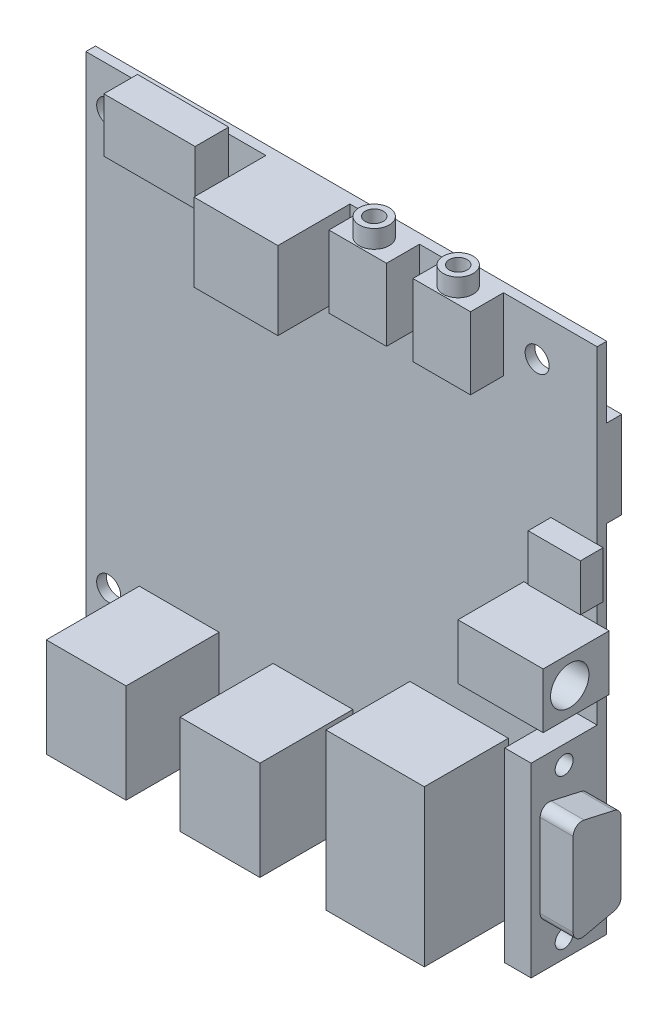
from build123d import *

# Parameters (mm, degrees)
SCHIZZO1_W                    = 85.2
SCHIZZO1_H                    = 85.6
SCHIZZO1_R                    = 2
ESTRUSIONE_ESTRUSIONE1_DEPTH  = 1.6
SCHIZZO3_W                    = 15.2
SCHIZZO3_H                    = 9
ESTRUSIONE_ESTRUSIONE2_DEPTH  = 5.6
SCHIZZO4_W                    = 14
SCHIZZO4_H                    = 13
ESTRUSIONE_ESTRUSIONE3_DEPTH  = 12
SCHIZZO5_W                    = 9.6
SCHIZZO5_H                    = 12
ESTRUSIONE_ESTRUSIONE4_DEPTH  = 5.5
SCHIZZO6_R                    = 2.5
SCHIZZO6_R_2                  = 1.5
ESTRUSIONE_SOTTILE1_DEPTH     = 3
SCHIZZO7_W                    = 16
SCHIZZO7_H                    = 14.5
ESTRUSIONE_ESTRUSIONE5_DEPTH  = 2.5
SCHIZZO8_W                    = 8.7
SCHIZZO8_H                    = 7.8
ESTRUSIONE_ESTRUSIONE6_DEPTH  = 3.8
SCHIZZO9_W                    = 14.2
SCHIZZO9_H                    = 9.2
ESTRUSIONE_ESTRUSIONE7_DEPTH  = 11
SCHIZZO10_R                   = 3.2
TAGLIO_ESTRUSIONE1_DEPTH      = 10
SCHIZZO11_W                   = 4.4
SCHIZZO11_H                   = 31
ESTRUSIONE_ESTRUSIONE8_DEPTH  = 11
ESTRUSIONE_ESTRUSIONE9_DEPTH  = 5.5
SCHIZZO14_R                   = 1.5
TAGLIO_ESTRUSIONE2_DEPTH      = 5.5
SCHIZZO15_W                   = 16.4
SCHIZZO15_H                   = 26
ESTRUSIONE_ESTRUSIONE10_DEPTH = 14
SCHIZZO16_W                   = 13.3
SCHIZZO16_H                   = 16.5
ESTRUSIONE_ESTRUSIONE11_DEPTH = 15.5
SCHIZZO17_W                   = 7.3
SCHIZZO17_H                   = 13
SCHIZZO17_W_2                 = 5
SCHIZZO17_H_2                 = 35.6
ESTRUSIONE_ESTRUSIONE12_DEPTH = 3.9


with BuildPart() as part:
    # Schizzo1 → Estrusione-Estrusione1 (new body)
    with BuildSketch(Plane.XY):
        Rectangle(SCHIZZO1_W, SCHIZZO1_H)
        with Locations((-38.8, 36)):
            Circle(SCHIZZO1_R, mode=Mode.SUBTRACT)
        with Locations((32.6, 36)):
            Circle(SCHIZZO1_R, mode=Mode.SUBTRACT)
        with Locations((-38.8, -32.8)):
            Circle(SCHIZZO1_R, mode=Mode.SUBTRACT)
        with Locations((32.6, -32.8)):
            Circle(SCHIZZO1_R, mode=Mode.SUBTRACT)
    extrude(amount=ESTRUSIONE_ESTRUSIONE1_DEPTH)

    # Schizzo3 → Estrusione-Estrusione2 (add)
    with BuildSketch(Plane.XY.offset(1.6)):
        with Locations((-26.4, 39.3)):
            Rectangle(SCHIZZO3_W, SCHIZZO3_H)
    extrude(amount=ESTRUSIONE_ESTRUSIONE2_DEPTH)

    # Schizzo4 → Estrusione-Estrusione3 (add)
    with BuildSketch(Plane.XY.offset(1.6)):
        with Locations((-5.6, 36.3)):
            Rectangle(SCHIZZO4_W, SCHIZZO4_H)
    extrude(amount=ESTRUSIONE_ESTRUSIONE3_DEPTH)

    # Schizzo5 → Estrusione-Estrusione4 (add)
    with BuildSketch(Plane.XY.offset(1.6)):
        with Locations((8.2, 36.8)):
            Rectangle(SCHIZZO5_W, SCHIZZO5_H)
        with Locations((22.2, 36.8)):
            Rectangle(SCHIZZO5_W, SCHIZZO5_H)
    extrude(amount=ESTRUSIONE_ESTRUSIONE4_DEPTH)

    # Schizzo6 → Estrusione-Sottile1 (add)
    # profile 1 of 2: a face of its own
    with BuildSketch(Plane(origin=(0, 42.8, 0), x_dir=(1, 0, 0), z_dir=(0, 1, 0))):
        with Locations((8.2, -4.35)):
            Circle(SCHIZZO6_R)
        with Locations((8.2, -4.35)):
            Circle(SCHIZZO6_R_2, mode=Mode.SUBTRACT)
    # profile 2 of 2: a face of its own
    with BuildSketch(Plane(origin=(0, 42.8, 0), x_dir=(1, 0, 0), z_dir=(0, 1, 0))):
        with Locations((22.2, -4.35)):
            Circle(SCHIZZO6_R)
        with Locations((22.2, -4.35)):
            Circle(SCHIZZO6_R_2, mode=Mode.SUBTRACT)
    extrude(amount=ESTRUSIONE_SOTTILE1_DEPTH)

    # Schizzo7 → Estrusione-Estrusione5 (add)
    with BuildSketch(Plane(origin=(0, 0, 0), x_dir=(-1, 0, 0), z_dir=(0, 0, -1))):
        with Locations((-34.6, 23.75)):
            Rectangle(SCHIZZO7_W, SCHIZZO7_H)
    extrude(amount=ESTRUSIONE_ESTRUSIONE5_DEPTH)

    # Schizzo8 → Estrusione-Estrusione6 (add)
    with BuildSketch(Plane.XY.offset(1.6)):
        with Locations((39.25, 10.4)):
            Rectangle(SCHIZZO8_W, SCHIZZO8_H)
    extrude(amount=ESTRUSIONE_ESTRUSIONE6_DEPTH)

    # Schizzo9 → Estrusione-Estrusione7 (add)
    with BuildSketch(Plane.XY.offset(1.6)):
        with Locations((37.5, -1.8)):
            Rectangle(SCHIZZO9_W, SCHIZZO9_H)
    extrude(amount=ESTRUSIONE_ESTRUSIONE7_DEPTH)

    # Schizzo10 → Taglio-Estrusione1 (cut)
    with BuildSketch(Plane(origin=(44.6, 0, 0), x_dir=(0, 0, -1), z_dir=(1, 0, 0))):
        with Locations((-8.163212145, -1.8)):
            Circle(SCHIZZO10_R)
    extrude(amount=-TAGLIO_ESTRUSIONE1_DEPTH, mode=Mode.SUBTRACT)

    # Schizzo11 → Estrusione-Estrusione8 (add)
    with BuildSketch(Plane.XY.offset(1.6)):
        with Locations((40.4, -27.3)):
            Rectangle(SCHIZZO11_W, SCHIZZO11_H)
    extrude(amount=ESTRUSIONE_ESTRUSIONE8_DEPTH)

    # Schizzo12 → Estrusione-Estrusione9 (add)
    with BuildSketch(Plane(origin=(42.6, 0, 0), x_dir=(0, 0, -1), z_dir=(1, 0, 0))):
        with BuildLine():
            Line((-11.1, -34.225), (-11.1, -20.375))
            ThreePointArc((-11.1, -20.375), (-10.537042571, -19.203696786), (-9.270731707, -18.911585366))
            Line((-9.270731707, -18.911585366), (-4.270731707, -20.036585366))
            ThreePointArc((-4.270731707, -20.036585366), (-3.428696786, -20.562957429), (-3.1, -21.5))
            Line((-3.1, -21.5), (-3.1, -33.1))
            ThreePointArc((-3.1, -33.1), (-3.428696786, -34.037042571), (-4.270731707, -34.563414634))
            Line((-4.270731707, -34.563414634), (-9.270731707, -35.688414634))
            ThreePointArc((-9.270731707, -35.688414634), (-10.537042571, -35.396303214), (-11.1, -34.225))
        make_face()
    extrude(amount=ESTRUSIONE_ESTRUSIONE9_DEPTH)

    # Schizzo14 → Taglio-Estrusione2 (cut)
    with BuildSketch(Plane(origin=(42.6, 0, 0), x_dir=(0, 0, -1), z_dir=(1, 0, 0))):
        with Locations((-7.1, -14.8)):
            Circle(SCHIZZO14_R)
        with Locations((-7.1, -39.8)):
            Circle(SCHIZZO14_R)
    extrude(amount=-TAGLIO_ESTRUSIONE2_DEPTH, mode=Mode.SUBTRACT)

    # Schizzo15 → Estrusione-Estrusione10 (add)
    with BuildSketch(Plane.XY.offset(1.6)):
        with Locations((19.6, -34.1)):
            Rectangle(SCHIZZO15_W, SCHIZZO15_H)
    extrude(amount=ESTRUSIONE_ESTRUSIONE10_DEPTH)

    # Schizzo16 → Estrusione-Estrusione11 (add)
    with BuildSketch(Plane.XY.offset(1.6)):
        with Locations((-27.05, -38.15)):
            Rectangle(SCHIZZO16_W, SCHIZZO16_H)
        with Locations((-4.75, -38.15)):
            Rectangle(SCHIZZO16_W, SCHIZZO16_H)
    extrude(amount=ESTRUSIONE_ESTRUSIONE11_DEPTH)

    # Schizzo17 → Estrusione-Estrusione12 (add)
    with BuildSketch(Plane(origin=(0, 0, 0), x_dir=(-1, 0, 0), z_dir=(0, 0, -1))):
        with Locations((36.55, 18)):
            Rectangle(SCHIZZO17_W, SCHIZZO17_H)
        with Locations((36.9, -9)):
            Rectangle(SCHIZZO17_W_2, SCHIZZO17_H_2)
    extrude(amount=ESTRUSIONE_ESTRUSIONE12_DEPTH)


solid = part.part
